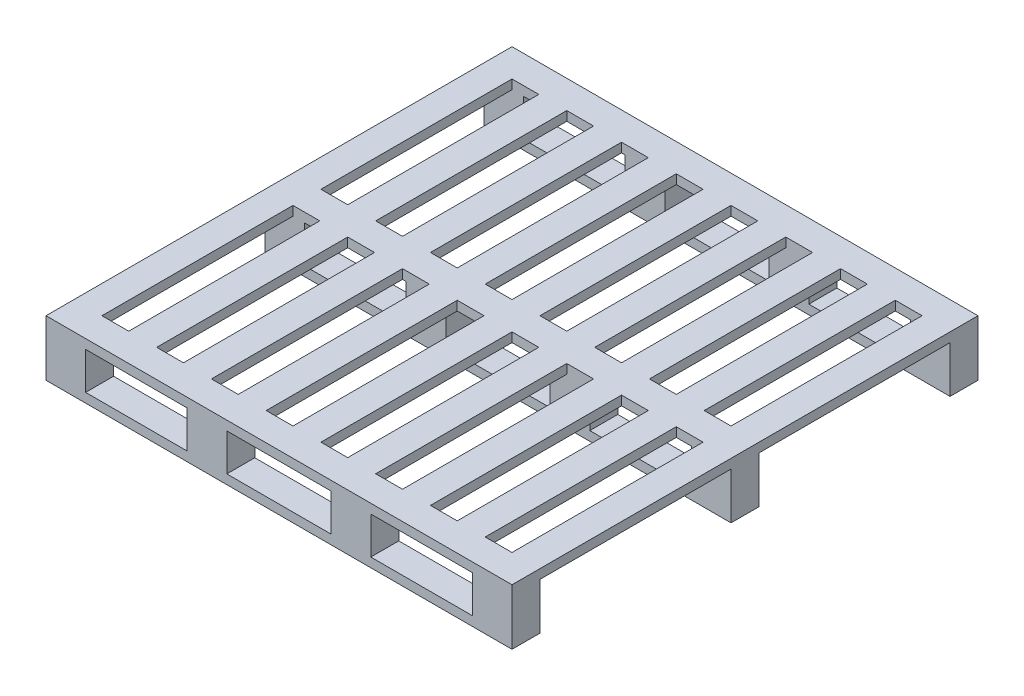
from build123d import *

# Parameters (mm, degrees)
SKETCH1_W             = 60
SKETCH1_H             = 1000
BOSS_EXTRUDE1_DEPTH   = 20
BOSS_EXTRUDE1_2_DEPTH = 20
BOSS_EXTRUDE1_3_DEPTH = 20
BOSS_EXTRUDE1_4_DEPTH = 20
SKETCH2_W             = 1000
SKETCH2_H             = 60
BOSS_EXTRUDE2_DEPTH   = 20
SKETCH3_W             = 85
SKETCH3_H             = 60
BOSS_EXTRUDE3_DEPTH   = 80
SKETCH4_W             = 1000
SKETCH4_H             = 60
BOSS_EXTRUDE4_DEPTH   = 20
SKETCH5_W             = 60
SKETCH5_H             = 1000
BOSS_EXTRUDE5_DEPTH   = 20
SKETCH6_W             = 410
SKETCH6_H             = 20
CUT_EXTRUDE1_DEPTH    = 1000


with BuildPart() as part:
    # Sketch1 → Boss-Extrude1 (new body)
    with BuildSketch(Plane(origin=(0, 0, 0), x_dir=(1, 0, 0), z_dir=(0, 1, 0))):
        with Locations((-470, 0)):
            Rectangle(SKETCH1_W, SKETCH1_H)
    extrude(amount=BOSS_EXTRUDE1_DEPTH)



with BuildPart() as body_2:
    # Sketch1 → Boss-Extrude1 2 (new body)
    with BuildSketch(Plane(origin=(0, 0, 0), x_dir=(1, 0, 0), z_dir=(0, 1, 0))):
        with Locations((470, 0)):
            Rectangle(SKETCH1_W, SKETCH1_H)
    extrude(amount=BOSS_EXTRUDE1_2_DEPTH)


with BuildPart() as body_3:
    # Sketch1 → Boss-Extrude1 3 (new body)
    with BuildSketch(Plane(origin=(0, 0, 0), x_dir=(1, 0, 0), z_dir=(0, 1, 0))):
        with Locations((-156.67, 0)):
            Rectangle(SKETCH1_W, SKETCH1_H)
    extrude(amount=BOSS_EXTRUDE1_3_DEPTH)


with BuildPart() as body_4:
    # Sketch1 → Boss-Extrude1 4 (new body)
    with BuildSketch(Plane(origin=(0, 0, 0), x_dir=(1, 0, 0), z_dir=(0, 1, 0))):
        with Locations((156.67, 0)):
            Rectangle(SKETCH1_W, SKETCH1_H)
    extrude(amount=BOSS_EXTRUDE1_4_DEPTH)


with BuildPart() as part_1:
    add(part.part)

    add(body_2.part)  # Boss-Extrude2 merges body 2

    add(body_3.part)  # Boss-Extrude2 merges body 3

    add(body_4.part)  # Boss-Extrude2 merges body 4
    # Sketch2 → Boss-Extrude2 (add)
    with BuildSketch(Plane(origin=(0, 0, 0), x_dir=(1, 0, 0), z_dir=(0, 1, 0))):
        with Locations((0, -470)):
            Rectangle(SKETCH2_W, SKETCH2_H)
        with Locations((0, 470)):
            Rectangle(SKETCH2_W, SKETCH2_H)
        Rectangle(SKETCH2_W, SKETCH2_H)
    extrude(amount=BOSS_EXTRUDE2_DEPTH)

    # Sketch3 → Boss-Extrude3 (add)
    with BuildSketch(Plane(origin=(0, 20, 0), x_dir=(1, 0, 0), z_dir=(0, 1, 0))):
        with Locations((457.5, -470)):
            Rectangle(SKETCH3_W, SKETCH3_H)
        with Locations((457.5, 470)):
            Rectangle(SKETCH3_W, SKETCH3_H)
        with Locations((457.5, 0)):
            Rectangle(SKETCH3_W, SKETCH3_H)
        with Locations((154.5, -470)):
            Rectangle(SKETCH3_W, SKETCH3_H)
        with Locations((154.5, 0)):
            Rectangle(SKETCH3_W, SKETCH3_H)
        with Locations((154.5, 470)):
            Rectangle(SKETCH3_W, SKETCH3_H)
        with Locations((-154.5, 470)):
            Rectangle(SKETCH3_W, SKETCH3_H)
        with Locations((-154.5, 0)):
            Rectangle(SKETCH3_W, SKETCH3_H)
        with Locations((-154.5, -470)):
            Rectangle(SKETCH3_W, SKETCH3_H)
        with Locations((-457.5, 0)):
            Rectangle(SKETCH3_W, SKETCH3_H)
        with Locations((-457.5, 470)):
            Rectangle(SKETCH3_W, SKETCH3_H)
        with Locations((-457.5, -470)):
            Rectangle(SKETCH3_W, SKETCH3_H)
    extrude(amount=BOSS_EXTRUDE3_DEPTH)

    # Sketch4 → Boss-Extrude4 (add)
    with BuildSketch(Plane(origin=(0, 100, 0), x_dir=(1, 0, 0), z_dir=(0, 1, 0))):
        with Locations((0, -470)):
            Rectangle(SKETCH4_W, SKETCH4_H)
        Rectangle(SKETCH4_W, SKETCH4_H)
        with Locations((0, 470)):
            Rectangle(SKETCH4_W, SKETCH4_H)
    extrude(amount=BOSS_EXTRUDE4_DEPTH)

    # Sketch5 → Boss-Extrude5 (add)
    with BuildSketch(Plane(origin=(0, 120, 0), x_dir=(1, 0, 0), z_dir=(0, 1, 0))):
        with Locations((-470, 0)):
            Rectangle(SKETCH5_W, SKETCH5_H)
        with Locations((-352.5, 0)):
            Rectangle(SKETCH5_W, SKETCH5_H)
        with Locations((-235, 0)):
            Rectangle(SKETCH5_W, SKETCH5_H)
        with Locations((-117.5, 0)):
            Rectangle(SKETCH5_W, SKETCH5_H)
        Rectangle(SKETCH5_W, SKETCH5_H)
        with Locations((117.5, 0)):
            Rectangle(SKETCH5_W, SKETCH5_H)
        with Locations((235, 0)):
            Rectangle(SKETCH5_W, SKETCH5_H)
        with Locations((352.5, 0)):
            Rectangle(SKETCH5_W, SKETCH5_H)
        with Locations((470, 0)):
            Rectangle(SKETCH5_W, SKETCH5_H)
    extrude(amount=-BOSS_EXTRUDE5_DEPTH)

    # Sketch6 → Cut-Extrude1 (cut)
    with BuildSketch(Plane(origin=(500, 0, 0), x_dir=(0, 0, -1), z_dir=(1, 0, 0))):
        with Locations((-235, 10)):
            Rectangle(SKETCH6_W, SKETCH6_H)
        with Locations((235, 10)):
            Rectangle(SKETCH6_W, SKETCH6_H)
    extrude(amount=-CUT_EXTRUDE1_DEPTH, mode=Mode.SUBTRACT)


solid = part_1.part
